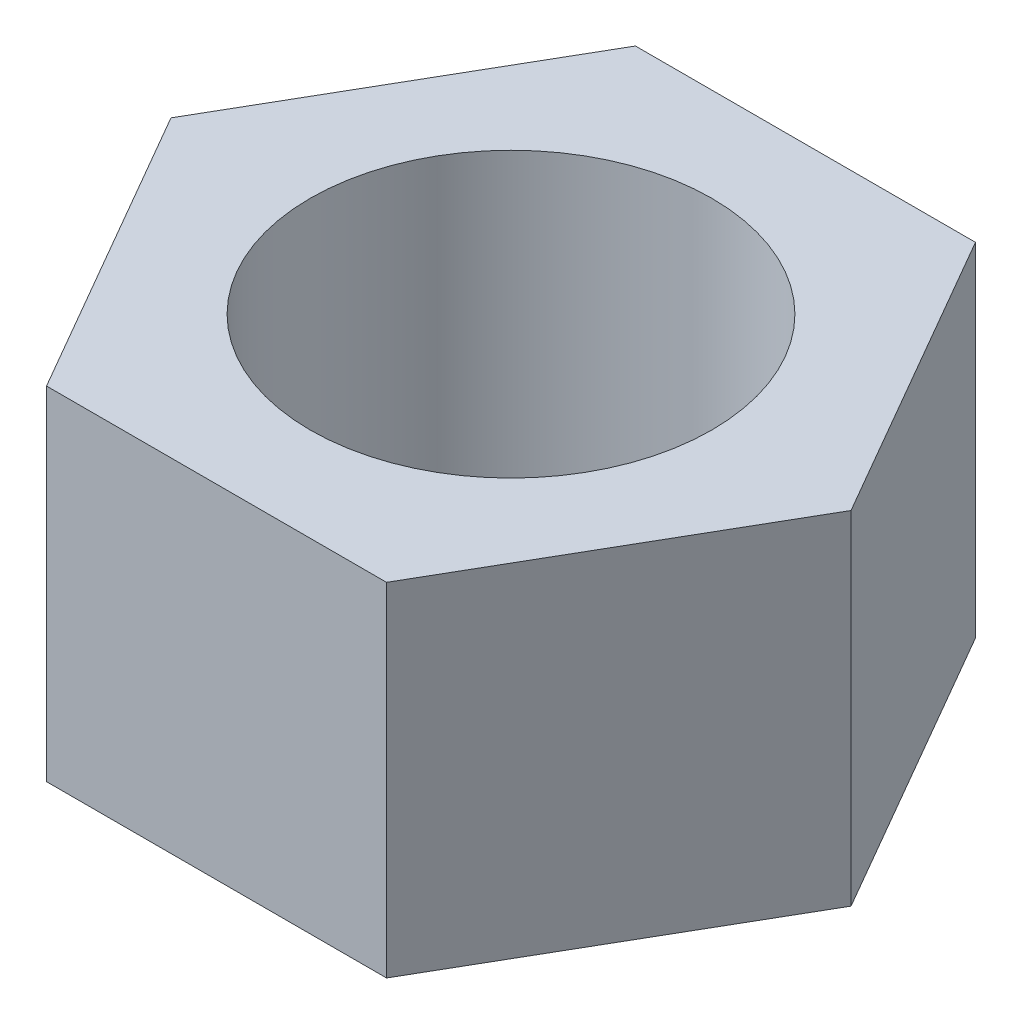
from build123d import *

# Parameters (mm, degrees)
SKETCH1_R           = 9.525
BOSS_EXTRUDE1_DEPTH = 16.256


with BuildPart() as part:
    # Sketch1 → Boss-Extrude1 (new body)
    with BuildSketch(Plane(origin=(0, 0, 0), x_dir=(1, 0, 0), z_dir=(0, 1, 0))):
        Polygon((8.065583261, 13.97), (-8.065583261, 13.97), (-16.131166521, 0), (-8.065583261, -13.97), (8.065583261, -13.97), (16.131166521, 0), align=None)
        with Locations(Location((0, 0, 0), (0, 0, 270))):
            Circle(SKETCH1_R, mode=Mode.SUBTRACT)
    extrude(amount=BOSS_EXTRUDE1_DEPTH)


solid = part.part
